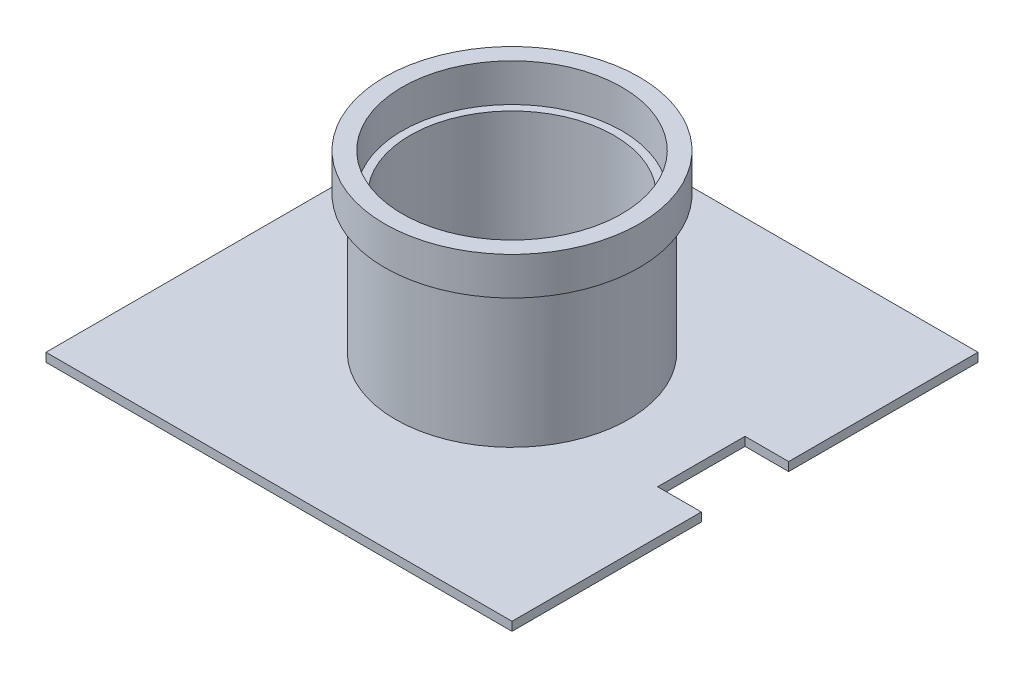
from build123d import *

# Parameters (mm, degrees)
CROQUIS1_R              = 43.7
CROQUIS1_R_2            = 37.7
SALIENTE_EXTRUIR1_DEPTH = 13
CROQUIS2_R              = 40
CROQUIS2_R_2            = 35
SALIENTE_EXTRUIR2_DEPTH = 50
CROQUIS3_R              = 35
SALIENTE_EXTRUIR3_DEPTH = 3


with BuildPart() as part:
    # Croquis1 → Saliente-Extruir1 (new body)
    with BuildSketch(Plane(origin=(0, 0, 0), x_dir=(1, 0, 0), z_dir=(0, 1, 0))):
        with Locations(Location((0, 0, 0), (0, 0, 90))):
            Circle(CROQUIS1_R)
        with Locations(Location((0, 0, 0), (0, 0, 90))):
            Circle(CROQUIS1_R_2, mode=Mode.SUBTRACT)
    extrude(amount=SALIENTE_EXTRUIR1_DEPTH)

    # Croquis2 → Saliente-Extruir2 (add)
    with BuildSketch(Plane.XZ):
        with Locations(Location((0, 0, 0), (0, 0, 90))):
            Circle(CROQUIS2_R)
        with Locations(Location((0, 0, 0), (0, 0, 270))):
            Circle(CROQUIS2_R_2, mode=Mode.SUBTRACT)
    extrude(amount=SALIENTE_EXTRUIR2_DEPTH)


with BuildPart() as body_2:
    # Croquis3 → Saliente-Extruir3 (new body)
    with BuildSketch(Plane.XZ.offset(50)):
        Polygon((0, 80), (80, 80), (80, 15), (65, 15), (65, 0), (65, -15), (80, -15), (80, -80), (-80, -80), (-80, 80), align=None)
        with Locations(Location((0, 0, 0), (0, 0, 270))):
            Circle(CROQUIS3_R, mode=Mode.SUBTRACT)
    extrude(amount=-SALIENTE_EXTRUIR3_DEPTH)


solid = Compound([part.part, body_2.part])
